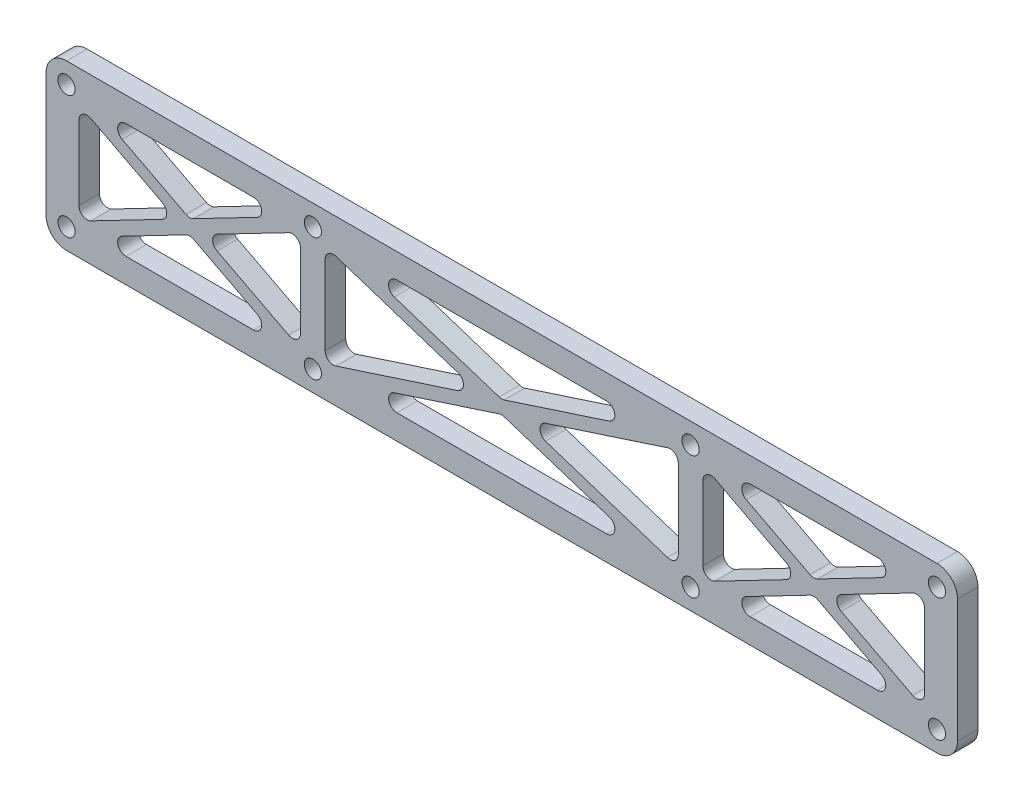
from build123d import *

# Parameters (mm, degrees)
SKETCH_1_W          = 232
SKETCH_1_H          = 40
SKETCH_1_R          = 2.1
EXTRUDE_2_DEPTH     = 5
SKETCH_3_R          = 2.1
CUT_EXTRUDE_2_DEPTH = 5
CUT_EXTRUDE_4_DEPTH = 5
FILLET_1_R          = 2


with BuildPart() as part:
    # 草图1 → 凸台-拉伸2 (new body)
    with BuildSketch(Plane.XY):
        Rectangle(SKETCH_1_W, SKETCH_1_H)
        with Locations((-46, 15)):
            Circle(SKETCH_1_R, mode=Mode.SUBTRACT)
        with Locations((46, 15)):
            Circle(SKETCH_1_R, mode=Mode.SUBTRACT)
        with Locations((46, -15)):
            Circle(SKETCH_1_R, mode=Mode.SUBTRACT)
        with Locations((-46, -15)):
            Circle(SKETCH_1_R, mode=Mode.SUBTRACT)
    extrude(amount=EXTRUDE_2_DEPTH)

    # 草图3 → 切除-拉伸2 (cut, symmetric)
    with BuildSketch(Plane.XY.offset(5)):
        with BuildLine():
            Line((-111, -15), (-111, 15))
            ThreePointArc((-111, 15), (-109.535533906, 18.535533906), (-106, 20))
            Line((-106, 20), (-116, 20))
            Line((-116, 20), (-116, -20))
            Line((-116, -20), (-106, -20))
            ThreePointArc((-106, -20), (-109.535533906, -18.535533906), (-111, -15))
        make_face()
        with Locations((-106, 15)):
            Circle(SKETCH_3_R)
        with Locations((-106, -15)):
            Circle(SKETCH_3_R)
        with BuildLine():
            Line((116, 20), (106, 20))
            ThreePointArc((106, 20), (109.535533906, 18.535533906), (111, 15))
            Line((111, 15), (111, -15))
            ThreePointArc((111, -15), (109.535533906, -18.535533906), (106, -20))
            Line((106, -20), (116, -20))
            Line((116, -20), (116, 20))
        make_face()
        with Locations((106, 15)):
            Circle(SKETCH_3_R)
        with Locations((106, -15)):
            Circle(SKETCH_3_R)
    extrude(amount=CUT_EXTRUDE_2_DEPTH, both=True, mode=Mode.SUBTRACT)

    # 草图4 → 切除-拉伸4 (cut, symmetric)
    with BuildSketch(Plane.XY.offset(5)):
        Polygon((-99.741377216, 14), (-76, 1.689656258), (-52.258622784, 14), align=None)
        Polygon((-103, 12.310343742), (-103, -12.310343742), (-79.258622784, 0), align=None)
        Polygon((-49, 12.310343742), (-72.741377216, 0), (-49, -12.310343742), align=None)
        Polygon((-76, -1.689656258), (-99.741377216, -14), (-52.258622784, -14), align=None)
        Polygon((-43, 12.422499667), (-43, -12.422499667), (-4.845179595, 0), align=None)
        Polygon((-38.154820405, 14), (0, 1.577500333), (38.154820405, 14), align=None)
        Polygon((43, 12.422499667), (4.845179595, 0), (43, -12.422499667), align=None)
        Polygon((0, -1.577500333), (-38.154820405, -14), (38.154820405, -14), align=None)
        Polygon((49, -12.310343742), (72.741377216, 0), (49, 12.310343742), align=None)
        Polygon((76, 1.689656258), (99.741377216, 14), (52.258622784, 14), align=None)
        Polygon((103, 12.310343742), (79.258622784, 0), (103, -12.310343742), align=None)
        Polygon((99.741377216, -14), (76, -1.689656258), (52.258622784, -14), align=None)
    extrude(amount=CUT_EXTRUDE_4_DEPTH, both=True, mode=Mode.SUBTRACT)

    # 圆角1
    fillet_1_edges = [part.edges().sort_by_distance(p)[0] for p in [
        (4.845179595, 0, 2.5),
        (43, 12.422499667, 2.5),
        (43, -12.422499667, 2.5),
        (0, 1.577500333, 2.5),
        (-38.154820405, 14, 2.5),
        (38.154820405, 14, 2.5),
        (-38.154820405, -14, 2.5),
        (0, -1.577500333, 2.5),
        (38.154820405, -14, 2.5),
        (49, -12.310343742, 2.5),
        (49, 12.310343742, 2.5),
        (72.741377216, 0, 2.5),
        (-103, -12.310343742, 2.5),
        (-103, 12.310343742, 2.5),
        (-79.258622784, 0, 2.5),
        (-72.741377216, 0, 2.5),
        (-49, 12.310343742, 2.5),
        (-49, -12.310343742, 2.5),
        (-76, -1.689656258, 2.5),
        (-52.258622784, -14, 2.5),
        (-99.741377216, -14, 2.5),
        (-43, -12.422499667, 2.5),
        (-43, 12.422499667, 2.5),
        (-4.845179595, 0, 2.5),
        (99.741377216, -14, 2.5),
        (52.258622784, -14, 2.5),
        (76, -1.689656258, 2.5),
        (99.741377216, 14, 2.5),
        (76, 1.689656258, 2.5),
        (52.258622784, 14, 2.5),
        (103, -12.310343742, 2.5),
        (79.258622784, 0, 2.5),
        (103, 12.310343742, 2.5),
        (-99.741377216, 14, 2.5),
        (-52.258622784, 14, 2.5),
        (-76, 1.689656258, 2.5),
    ]]
    fillet(fillet_1_edges, radius=FILLET_1_R)


solid = part.part
